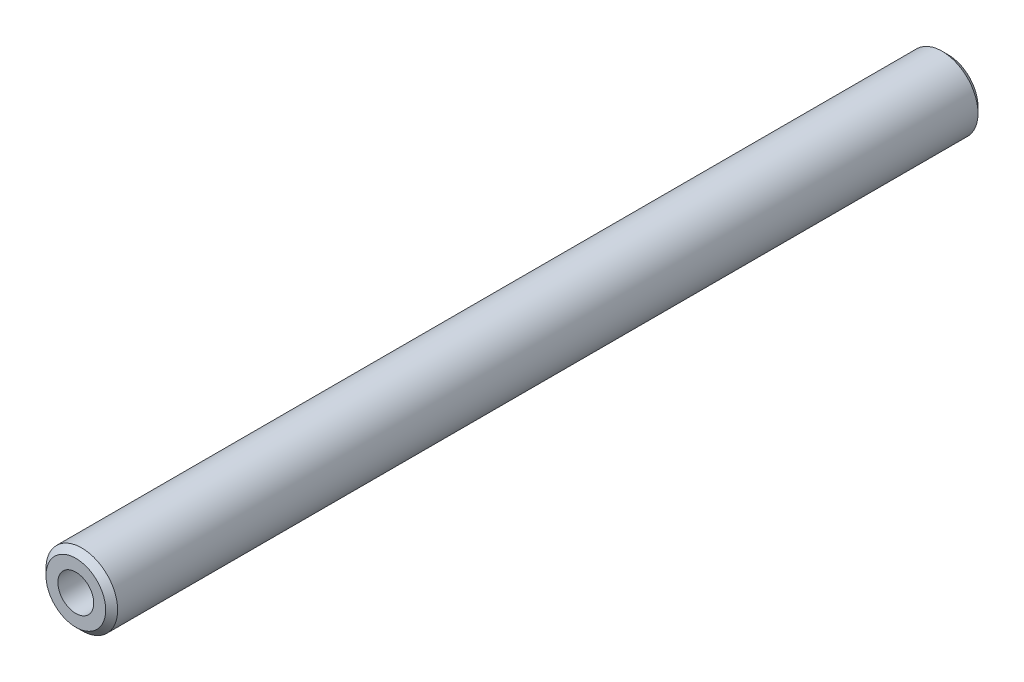
from build123d import *

# Parameters (mm, degrees)
SKETCH_1_R      = 6
SKETCH_1_R_2    = 3
EXTRUDE_1_DEPTH = 146
CHAMFER_1_SIZE  = 1


with BuildPart() as part:
    # 草图1 → 凸台-拉伸1 (new body)
    with BuildSketch(Plane.XY):
        Circle(SKETCH_1_R)
        Circle(SKETCH_1_R_2, mode=Mode.SUBTRACT)
    extrude(amount=EXTRUDE_1_DEPTH)

    # 倒角1
    chamfer_1_edges = [part.edges().sort_by_distance(p)[0] for p in [
        (-6, 0, 0),
        (-6, 0, 146),
    ]]
    chamfer(chamfer_1_edges, length=CHAMFER_1_SIZE)


solid = part.part
